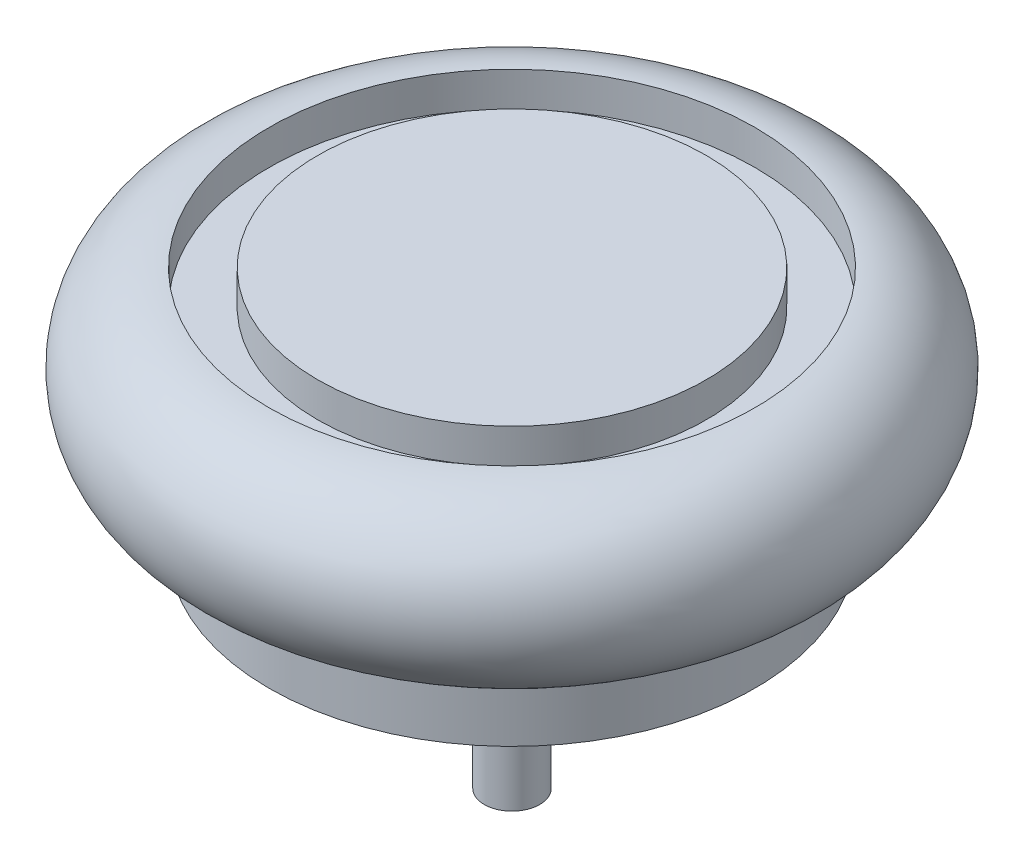
from build123d import *

# Parameters (mm, degrees)
BOSS_EXTRUDE2_START = 20
SKETCH3_R           = 70
SKETCH3_R_2         = 40
BOSS_EXTRUDE2_DEPTH = 20
SKETCH4_R           = 8
BOSS_EXTRUDE3_DEPTH = 80


with BuildPart() as part:
    # Sketch2 → Revolve1 (revolve)
    with BuildSketch(Plane.YZ):
        with BuildLine():
            Line((0, 0), (0, 70))
            ThreePointArc((0, 70), (25, 95), (50, 70))
            Line((50, 70), (40, 70))
            Line((40, 70), (40, 56))
            Line((40, 56), (50, 56))
            Line((50, 56), (50, 0))
            Line((50, 0), (0, 0))
        make_face()
    revolve(axis=Axis((0, 50, 0), (0, -1, 0)))

    # Sketch3 → Boss-Extrude2 (add)
    with BuildSketch(Plane.XZ.offset(BOSS_EXTRUDE2_START)):
        with Locations(Location((0, 0, 0), (0, 0, 90))):
            Circle(SKETCH3_R)
        with Locations(Location((0, 0, 0), (0, 0, 270))):
            Circle(SKETCH3_R_2, mode=Mode.SUBTRACT)
    extrude(amount=-BOSS_EXTRUDE2_DEPTH)

    # Sketch4 → Boss-Extrude3 (add)
    with BuildSketch(Plane.XZ):
        with Locations(Location((0, 0, 0), (0, 0, 270))):
            Circle(SKETCH4_R)
    extrude(amount=BOSS_EXTRUDE3_DEPTH)


solid = part.part
